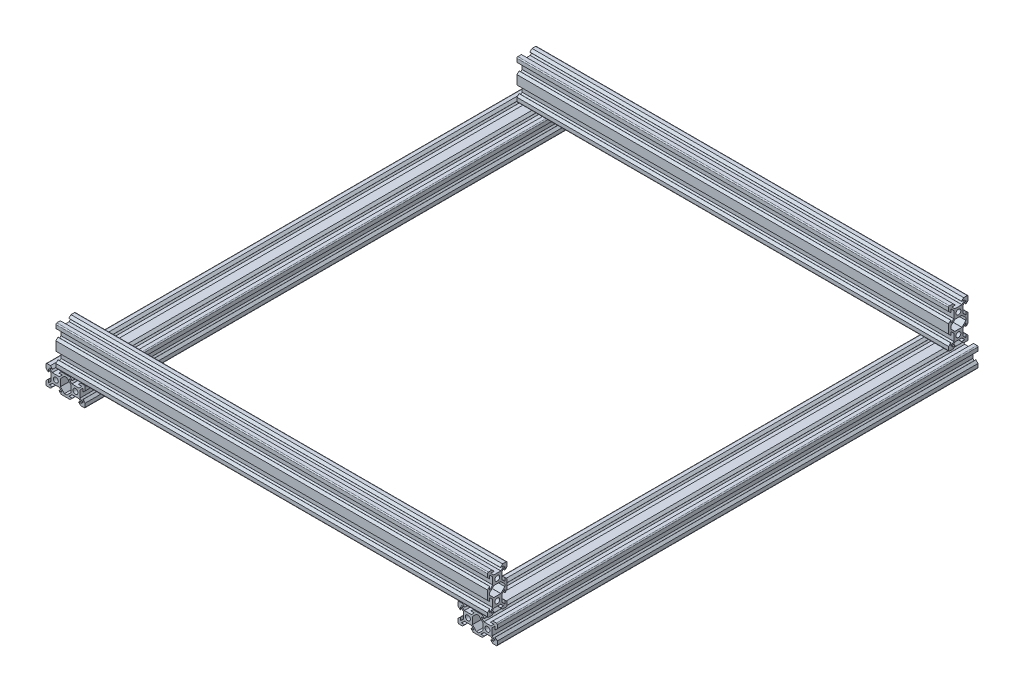
from build123d import *

# Parameters (mm, degrees)
CROQUIS4_R                   = 2.5
MIEMBRO_ESTRUCTURAL3_DEPTH   = 440
CROQUIS4_ON_SEGMENT_2_R      = 2.5
MIEMBRO_ESTRUCTURAL3_2_DEPTH = 440
CROQUIS41_R                  = 2.5
MIEMBRO_ESTRUCTURAL4_DEPTH   = 490
CROQUIS41_ON_SEGMENT_2_R     = 2.5
MIEMBRO_ESTRUCTURAL4_2_DEPTH = 490


with BuildPart() as part:
    # Croquis4 → Miembro estructural3 (new body)
    with BuildSketch(Plane(origin=(-220, 30, -235), x_dir=(0, 1, 0), z_dir=(1, 0, 0))):
        with BuildLine():
            Line((-19, -10), (-15.410285706, -10))
            Line((-15.410285706, -10), (-13.270710678, -7.860424973))
            ThreePointArc((-13.270710678, -7.860424973), (-13.249033403, -7.751445951), (-13.341421356, -7.689714294))
            Line((-13.341421356, -7.689714294), (-16.358578644, -7.689714294))
            ThreePointArc((-16.358578644, -7.689714294), (-16.450966597, -7.627982638), (-16.429289322, -7.519003616))
            Line((-16.429289322, -7.519003616), (-13.629289322, -4.719003616))
            ThreePointArc((-13.629289322, -4.719003616), (-13.596846987, -4.697326341), (-13.558578644, -4.689714294))
            Line((-13.558578644, -4.689714294), (-6.441421356, -4.689714294))
            ThreePointArc((-6.441421356, -4.689714294), (-6.403153013, -4.697326341), (-6.370710678, -4.719003616))
            Line((-6.370710678, -4.719003616), (-3.570710678, -7.519003616))
            ThreePointArc((-3.570710678, -7.519003616), (-3.549033403, -7.627982638), (-3.641421356, -7.689714294))
            Line((-3.641421356, -7.689714294), (-6.658578644, -7.689714294))
            ThreePointArc((-6.658578644, -7.689714294), (-6.750966597, -7.751445951), (-6.729289322, -7.860424973))
            Line((-6.729289322, -7.860424973), (-4.589714294, -10))
            Line((-4.589714294, -10), (4.589714294, -10))
            Line((4.589714294, -10), (6.729289322, -7.860424973))
            ThreePointArc((6.729289322, -7.860424973), (6.750966597, -7.751445951), (6.658578644, -7.689714294))
            Line((6.658578644, -7.689714294), (3.641421356, -7.689714294))
            ThreePointArc((3.641421356, -7.689714294), (3.549033403, -7.627982638), (3.570710678, -7.519003616))
            Line((3.570710678, -7.519003616), (6.370710678, -4.719003616))
            ThreePointArc((6.370710678, -4.719003616), (6.403153013, -4.697326341), (6.441421356, -4.689714294))
            Line((6.441421356, -4.689714294), (13.558578644, -4.689714294))
            ThreePointArc((13.558578644, -4.689714294), (13.596846987, -4.697326341), (13.629289322, -4.719003616))
            Line((13.629289322, -4.719003616), (16.429289322, -7.519003616))
            ThreePointArc((16.429289322, -7.519003616), (16.450966597, -7.627982638), (16.358578644, -7.689714294))
            Line((16.358578644, -7.689714294), (13.341421356, -7.689714294))
            ThreePointArc((13.341421356, -7.689714294), (13.249033403, -7.751445951), (13.270710678, -7.860424973))
            Line((13.270710678, -7.860424973), (15.410285706, -10))
            Line((15.410285706, -10), (19, -10))
            ThreePointArc((19, -10), (19.707106781, -9.707106781), (20, -9))
            Line((20, -9), (20, -5.410285706))
            Line((20, -5.410285706), (17.860424973, -3.270710678))
            ThreePointArc((17.860424973, -3.270710678), (17.751445951, -3.249033403), (17.689714294, -3.341421356))
            Line((17.689714294, -3.341421356), (17.689714294, -6.358578644))
            ThreePointArc((17.689714294, -6.358578644), (17.627982638, -6.450966597), (17.519003616, -6.429289322))
            Line((17.519003616, -6.429289322), (14.719003616, -3.629289322))
            ThreePointArc((14.719003616, -3.629289322), (14.697326341, -3.596846987), (14.689714294, -3.558578644))
            Line((14.689714294, -3.558578644), (14.689714294, 3.558578644))
            ThreePointArc((14.689714294, 3.558578644), (14.697326341, 3.596846987), (14.719003616, 3.629289322))
            Line((14.719003616, 3.629289322), (17.519003616, 6.429289322))
            ThreePointArc((17.519003616, 6.429289322), (17.627982638, 6.450966597), (17.689714294, 6.358578644))
            Line((17.689714294, 6.358578644), (17.689714294, 3.341421356))
            ThreePointArc((17.689714294, 3.341421356), (17.751445951, 3.249033403), (17.860424973, 3.270710678))
            Line((17.860424973, 3.270710678), (20, 5.410285706))
            Line((20, 5.410285706), (20, 9))
            ThreePointArc((20, 9), (19.707106781, 9.707106781), (19, 10))
            Line((19, 10), (15.410285706, 10))
            Line((15.410285706, 10), (13.270710678, 7.860424973))
            ThreePointArc((13.270710678, 7.860424973), (13.249033403, 7.751445951), (13.341421356, 7.689714294))
            Line((13.341421356, 7.689714294), (16.358578644, 7.689714294))
            ThreePointArc((16.358578644, 7.689714294), (16.450966597, 7.627982638), (16.429289322, 7.519003616))
            Line((16.429289322, 7.519003616), (13.629289322, 4.719003616))
            ThreePointArc((13.629289322, 4.719003616), (13.596846987, 4.697326341), (13.558578644, 4.689714294))
            Line((13.558578644, 4.689714294), (6.441421356, 4.689714294))
            ThreePointArc((6.441421356, 4.689714294), (6.403153013, 4.697326341), (6.370710678, 4.719003616))
            Line((6.370710678, 4.719003616), (3.570710678, 7.519003616))
            ThreePointArc((3.570710678, 7.519003616), (3.549033403, 7.627982638), (3.641421356, 7.689714294))
            Line((3.641421356, 7.689714294), (6.658578644, 7.689714294))
            ThreePointArc((6.658578644, 7.689714294), (6.750966597, 7.751445951), (6.729289322, 7.860424973))
            Line((6.729289322, 7.860424973), (4.589714294, 10))
            Line((4.589714294, 10), (-4.589714294, 10))
            Line((-4.589714294, 10), (-6.729289322, 7.860424973))
            ThreePointArc((-6.729289322, 7.860424973), (-6.750966597, 7.751445951), (-6.658578644, 7.689714294))
            Line((-6.658578644, 7.689714294), (-3.641421356, 7.689714294))
            ThreePointArc((-3.641421356, 7.689714294), (-3.549033403, 7.627982638), (-3.570710678, 7.519003616))
            Line((-3.570710678, 7.519003616), (-6.370710678, 4.719003616))
            ThreePointArc((-6.370710678, 4.719003616), (-6.403153013, 4.697326341), (-6.441421356, 4.689714294))
            Line((-6.441421356, 4.689714294), (-13.558578644, 4.689714294))
            ThreePointArc((-13.558578644, 4.689714294), (-13.596846987, 4.697326341), (-13.629289322, 4.719003616))
            Line((-13.629289322, 4.719003616), (-16.429289322, 7.519003616))
            ThreePointArc((-16.429289322, 7.519003616), (-16.450966597, 7.627982638), (-16.358578644, 7.689714294))
            Line((-16.358578644, 7.689714294), (-13.341421356, 7.689714294))
            ThreePointArc((-13.341421356, 7.689714294), (-13.249033403, 7.751445951), (-13.270710678, 7.860424973))
            Line((-13.270710678, 7.860424973), (-15.410285706, 10))
            Line((-15.410285706, 10), (-19, 10))
            ThreePointArc((-19, 10), (-19.707106781, 9.707106781), (-20, 9))
            Line((-20, 9), (-20, 5.410285706))
            Line((-20, 5.410285706), (-17.860424973, 3.270710678))
            ThreePointArc((-17.860424973, 3.270710678), (-17.751445951, 3.249033403), (-17.689714294, 3.341421356))
            Line((-17.689714294, 3.341421356), (-17.689714294, 6.358578644))
            ThreePointArc((-17.689714294, 6.358578644), (-17.627982638, 6.450966597), (-17.519003616, 6.429289322))
            Line((-17.519003616, 6.429289322), (-14.719003616, 3.629289322))
            ThreePointArc((-14.719003616, 3.629289322), (-14.697326341, 3.596846987), (-14.689714294, 3.558578644))
            Line((-14.689714294, 3.558578644), (-14.689714294, -3.558578644))
            ThreePointArc((-14.689714294, -3.558578644), (-14.697326341, -3.596846987), (-14.719003616, -3.629289322))
            Line((-14.719003616, -3.629289322), (-17.519003616, -6.429289322))
            ThreePointArc((-17.519003616, -6.429289322), (-17.627982638, -6.450966597), (-17.689714294, -6.358578644))
            Line((-17.689714294, -6.358578644), (-17.689714294, -3.341421356))
            ThreePointArc((-17.689714294, -3.341421356), (-17.751445951, -3.249033403), (-17.860424973, -3.270710678))
            Line((-17.860424973, -3.270710678), (-20, -5.410285706))
            Line((-20, -5.410285706), (-20, -9))
            ThreePointArc((-20, -9), (-19.707106781, -9.707106781), (-19, -10))
        make_face()
        with Locations((-10, 0)):
            Circle(CROQUIS4_R, mode=Mode.SUBTRACT)
        with Locations((10, 0)):
            Circle(CROQUIS4_R, mode=Mode.SUBTRACT)
        with BuildLine():
            Line((-2.480996384, 6.429289322), (-5.280996384, 3.629289322))
            ThreePointArc((-5.280996384, 3.629289322), (-5.302673659, 3.596846987), (-5.310285706, 3.558578644))
            Line((-5.310285706, 3.558578644), (-5.310285706, -3.558578644))
            ThreePointArc((-5.310285706, -3.558578644), (-5.302673659, -3.596846987), (-5.280996384, -3.629289322))
            Line((-5.280996384, -3.629289322), (-2.480996384, -6.429289322))
            Line((-2.480996384, -6.429289322), (-1.220571411, -7.689714294))
            Line((-1.220571411, -7.689714294), (1.220571411, -7.689714294))
            Line((1.220571411, -7.689714294), (2.480996384, -6.429289322))
            Line((2.480996384, -6.429289322), (5.280996384, -3.629289322))
            ThreePointArc((5.280996384, -3.629289322), (5.302673659, -3.596846987), (5.310285706, -3.558578644))
            Line((5.310285706, -3.558578644), (5.310285706, 3.558578644))
            ThreePointArc((5.310285706, 3.558578644), (5.302673659, 3.596846987), (5.280996384, 3.629289322))
            Line((5.280996384, 3.629289322), (2.480996384, 6.429289322))
            Line((2.480996384, 6.429289322), (1.220571411, 7.689714294))
            Line((1.220571411, 7.689714294), (-1.220571411, 7.689714294))
            Line((-1.220571411, 7.689714294), (-2.480996384, 6.429289322))
        make_face(mode=Mode.SUBTRACT)
    extrude(amount=MIEMBRO_ESTRUCTURAL3_DEPTH)


with BuildPart() as body_2:
    # Croquis4 on segment 2 (carried to segment 2) → Miembro estructural3 2 (new body)
    with BuildSketch(Plane(origin=(-220, 30, 235), x_dir=(0, 1, 0), z_dir=(1, 0, 0))):
        with BuildLine():
            Line((-19, -10), (-15.410285706, -10))
            Line((-15.410285706, -10), (-13.270710678, -7.860424973))
            ThreePointArc((-13.270710678, -7.860424973), (-13.249033403, -7.751445951), (-13.341421356, -7.689714294))
            Line((-13.341421356, -7.689714294), (-16.358578644, -7.689714294))
            ThreePointArc((-16.358578644, -7.689714294), (-16.450966597, -7.627982638), (-16.429289322, -7.519003616))
            Line((-16.429289322, -7.519003616), (-13.629289322, -4.719003616))
            ThreePointArc((-13.629289322, -4.719003616), (-13.596846987, -4.697326341), (-13.558578644, -4.689714294))
            Line((-13.558578644, -4.689714294), (-6.441421356, -4.689714294))
            ThreePointArc((-6.441421356, -4.689714294), (-6.403153013, -4.697326341), (-6.370710678, -4.719003616))
            Line((-6.370710678, -4.719003616), (-3.570710678, -7.519003616))
            ThreePointArc((-3.570710678, -7.519003616), (-3.549033403, -7.627982638), (-3.641421356, -7.689714294))
            Line((-3.641421356, -7.689714294), (-6.658578644, -7.689714294))
            ThreePointArc((-6.658578644, -7.689714294), (-6.750966597, -7.751445951), (-6.729289322, -7.860424973))
            Line((-6.729289322, -7.860424973), (-4.589714294, -10))
            Line((-4.589714294, -10), (4.589714294, -10))
            Line((4.589714294, -10), (6.729289322, -7.860424973))
            ThreePointArc((6.729289322, -7.860424973), (6.750966597, -7.751445951), (6.658578644, -7.689714294))
            Line((6.658578644, -7.689714294), (3.641421356, -7.689714294))
            ThreePointArc((3.641421356, -7.689714294), (3.549033403, -7.627982638), (3.570710678, -7.519003616))
            Line((3.570710678, -7.519003616), (6.370710678, -4.719003616))
            ThreePointArc((6.370710678, -4.719003616), (6.403153013, -4.697326341), (6.441421356, -4.689714294))
            Line((6.441421356, -4.689714294), (13.558578644, -4.689714294))
            ThreePointArc((13.558578644, -4.689714294), (13.596846987, -4.697326341), (13.629289322, -4.719003616))
            Line((13.629289322, -4.719003616), (16.429289322, -7.519003616))
            ThreePointArc((16.429289322, -7.519003616), (16.450966597, -7.627982638), (16.358578644, -7.689714294))
            Line((16.358578644, -7.689714294), (13.341421356, -7.689714294))
            ThreePointArc((13.341421356, -7.689714294), (13.249033403, -7.751445951), (13.270710678, -7.860424973))
            Line((13.270710678, -7.860424973), (15.410285706, -10))
            Line((15.410285706, -10), (19, -10))
            ThreePointArc((19, -10), (19.707106781, -9.707106781), (20, -9))
            Line((20, -9), (20, -5.410285706))
            Line((20, -5.410285706), (17.860424973, -3.270710678))
            ThreePointArc((17.860424973, -3.270710678), (17.751445951, -3.249033403), (17.689714294, -3.341421356))
            Line((17.689714294, -3.341421356), (17.689714294, -6.358578644))
            ThreePointArc((17.689714294, -6.358578644), (17.627982638, -6.450966597), (17.519003616, -6.429289322))
            Line((17.519003616, -6.429289322), (14.719003616, -3.629289322))
            ThreePointArc((14.719003616, -3.629289322), (14.697326341, -3.596846987), (14.689714294, -3.558578644))
            Line((14.689714294, -3.558578644), (14.689714294, 3.558578644))
            ThreePointArc((14.689714294, 3.558578644), (14.697326341, 3.596846987), (14.719003616, 3.629289322))
            Line((14.719003616, 3.629289322), (17.519003616, 6.429289322))
            ThreePointArc((17.519003616, 6.429289322), (17.627982638, 6.450966597), (17.689714294, 6.358578644))
            Line((17.689714294, 6.358578644), (17.689714294, 3.341421356))
            ThreePointArc((17.689714294, 3.341421356), (17.751445951, 3.249033403), (17.860424973, 3.270710678))
            Line((17.860424973, 3.270710678), (20, 5.410285706))
            Line((20, 5.410285706), (20, 9))
            ThreePointArc((20, 9), (19.707106781, 9.707106781), (19, 10))
            Line((19, 10), (15.410285706, 10))
            Line((15.410285706, 10), (13.270710678, 7.860424973))
            ThreePointArc((13.270710678, 7.860424973), (13.249033403, 7.751445951), (13.341421356, 7.689714294))
            Line((13.341421356, 7.689714294), (16.358578644, 7.689714294))
            ThreePointArc((16.358578644, 7.689714294), (16.450966597, 7.627982638), (16.429289322, 7.519003616))
            Line((16.429289322, 7.519003616), (13.629289322, 4.719003616))
            ThreePointArc((13.629289322, 4.719003616), (13.596846987, 4.697326341), (13.558578644, 4.689714294))
            Line((13.558578644, 4.689714294), (6.441421356, 4.689714294))
            ThreePointArc((6.441421356, 4.689714294), (6.403153013, 4.697326341), (6.370710678, 4.719003616))
            Line((6.370710678, 4.719003616), (3.570710678, 7.519003616))
            ThreePointArc((3.570710678, 7.519003616), (3.549033403, 7.627982638), (3.641421356, 7.689714294))
            Line((3.641421356, 7.689714294), (6.658578644, 7.689714294))
            ThreePointArc((6.658578644, 7.689714294), (6.750966597, 7.751445951), (6.729289322, 7.860424973))
            Line((6.729289322, 7.860424973), (4.589714294, 10))
            Line((4.589714294, 10), (-4.589714294, 10))
            Line((-4.589714294, 10), (-6.729289322, 7.860424973))
            ThreePointArc((-6.729289322, 7.860424973), (-6.750966597, 7.751445951), (-6.658578644, 7.689714294))
            Line((-6.658578644, 7.689714294), (-3.641421356, 7.689714294))
            ThreePointArc((-3.641421356, 7.689714294), (-3.549033403, 7.627982638), (-3.570710678, 7.519003616))
            Line((-3.570710678, 7.519003616), (-6.370710678, 4.719003616))
            ThreePointArc((-6.370710678, 4.719003616), (-6.403153013, 4.697326341), (-6.441421356, 4.689714294))
            Line((-6.441421356, 4.689714294), (-13.558578644, 4.689714294))
            ThreePointArc((-13.558578644, 4.689714294), (-13.596846987, 4.697326341), (-13.629289322, 4.719003616))
            Line((-13.629289322, 4.719003616), (-16.429289322, 7.519003616))
            ThreePointArc((-16.429289322, 7.519003616), (-16.450966597, 7.627982638), (-16.358578644, 7.689714294))
            Line((-16.358578644, 7.689714294), (-13.341421356, 7.689714294))
            ThreePointArc((-13.341421356, 7.689714294), (-13.249033403, 7.751445951), (-13.270710678, 7.860424973))
            Line((-13.270710678, 7.860424973), (-15.410285706, 10))
            Line((-15.410285706, 10), (-19, 10))
            ThreePointArc((-19, 10), (-19.707106781, 9.707106781), (-20, 9))
            Line((-20, 9), (-20, 5.410285706))
            Line((-20, 5.410285706), (-17.860424973, 3.270710678))
            ThreePointArc((-17.860424973, 3.270710678), (-17.751445951, 3.249033403), (-17.689714294, 3.341421356))
            Line((-17.689714294, 3.341421356), (-17.689714294, 6.358578644))
            ThreePointArc((-17.689714294, 6.358578644), (-17.627982638, 6.450966597), (-17.519003616, 6.429289322))
            Line((-17.519003616, 6.429289322), (-14.719003616, 3.629289322))
            ThreePointArc((-14.719003616, 3.629289322), (-14.697326341, 3.596846987), (-14.689714294, 3.558578644))
            Line((-14.689714294, 3.558578644), (-14.689714294, -3.558578644))
            ThreePointArc((-14.689714294, -3.558578644), (-14.697326341, -3.596846987), (-14.719003616, -3.629289322))
            Line((-14.719003616, -3.629289322), (-17.519003616, -6.429289322))
            ThreePointArc((-17.519003616, -6.429289322), (-17.627982638, -6.450966597), (-17.689714294, -6.358578644))
            Line((-17.689714294, -6.358578644), (-17.689714294, -3.341421356))
            ThreePointArc((-17.689714294, -3.341421356), (-17.751445951, -3.249033403), (-17.860424973, -3.270710678))
            Line((-17.860424973, -3.270710678), (-20, -5.410285706))
            Line((-20, -5.410285706), (-20, -9))
            ThreePointArc((-20, -9), (-19.707106781, -9.707106781), (-19, -10))
        make_face()
        with Locations((-10, 0)):
            Circle(CROQUIS4_ON_SEGMENT_2_R, mode=Mode.SUBTRACT)
        with Locations((10, 0)):
            Circle(CROQUIS4_ON_SEGMENT_2_R, mode=Mode.SUBTRACT)
        with BuildLine():
            Line((-2.480996384, 6.429289322), (-5.280996384, 3.629289322))
            ThreePointArc((-5.280996384, 3.629289322), (-5.302673659, 3.596846987), (-5.310285706, 3.558578644))
            Line((-5.310285706, 3.558578644), (-5.310285706, -3.558578644))
            ThreePointArc((-5.310285706, -3.558578644), (-5.302673659, -3.596846987), (-5.280996384, -3.629289322))
            Line((-5.280996384, -3.629289322), (-2.480996384, -6.429289322))
            Line((-2.480996384, -6.429289322), (-1.220571411, -7.689714294))
            Line((-1.220571411, -7.689714294), (1.220571411, -7.689714294))
            Line((1.220571411, -7.689714294), (2.480996384, -6.429289322))
            Line((2.480996384, -6.429289322), (5.280996384, -3.629289322))
            ThreePointArc((5.280996384, -3.629289322), (5.302673659, -3.596846987), (5.310285706, -3.558578644))
            Line((5.310285706, -3.558578644), (5.310285706, 3.558578644))
            ThreePointArc((5.310285706, 3.558578644), (5.302673659, 3.596846987), (5.280996384, 3.629289322))
            Line((5.280996384, 3.629289322), (2.480996384, 6.429289322))
            Line((2.480996384, 6.429289322), (1.220571411, 7.689714294))
            Line((1.220571411, 7.689714294), (-1.220571411, 7.689714294))
            Line((-1.220571411, 7.689714294), (-2.480996384, 6.429289322))
        make_face(mode=Mode.SUBTRACT)
    extrude(amount=MIEMBRO_ESTRUCTURAL3_2_DEPTH)


with BuildPart() as body_3:
    # Croquis41 → Miembro estructural4 (new body)
    with BuildSketch(Plane(origin=(-210, 0, -245), x_dir=(1, 0, 0), z_dir=(0, 0, 1))):
        with BuildLine():
            Line((-19, -10), (-15.410285706, -10))
            Line((-15.410285706, -10), (-13.270710678, -7.860424973))
            ThreePointArc((-13.270710678, -7.860424973), (-13.249033403, -7.751445951), (-13.341421356, -7.689714294))
            Line((-13.341421356, -7.689714294), (-16.358578644, -7.689714294))
            ThreePointArc((-16.358578644, -7.689714294), (-16.450966597, -7.627982638), (-16.429289322, -7.519003616))
            Line((-16.429289322, -7.519003616), (-13.629289322, -4.719003616))
            ThreePointArc((-13.629289322, -4.719003616), (-13.596846987, -4.697326341), (-13.558578644, -4.689714294))
            Line((-13.558578644, -4.689714294), (-6.441421356, -4.689714294))
            ThreePointArc((-6.441421356, -4.689714294), (-6.403153013, -4.697326341), (-6.370710678, -4.719003616))
            Line((-6.370710678, -4.719003616), (-3.570710678, -7.519003616))
            ThreePointArc((-3.570710678, -7.519003616), (-3.549033403, -7.627982638), (-3.641421356, -7.689714294))
            Line((-3.641421356, -7.689714294), (-6.658578644, -7.689714294))
            ThreePointArc((-6.658578644, -7.689714294), (-6.750966597, -7.751445951), (-6.729289322, -7.860424973))
            Line((-6.729289322, -7.860424973), (-4.589714294, -10))
            Line((-4.589714294, -10), (4.589714294, -10))
            Line((4.589714294, -10), (6.729289322, -7.860424973))
            ThreePointArc((6.729289322, -7.860424973), (6.750966597, -7.751445951), (6.658578644, -7.689714294))
            Line((6.658578644, -7.689714294), (3.641421356, -7.689714294))
            ThreePointArc((3.641421356, -7.689714294), (3.549033403, -7.627982638), (3.570710678, -7.519003616))
            Line((3.570710678, -7.519003616), (6.370710678, -4.719003616))
            ThreePointArc((6.370710678, -4.719003616), (6.403153013, -4.697326341), (6.441421356, -4.689714294))
            Line((6.441421356, -4.689714294), (13.558578644, -4.689714294))
            ThreePointArc((13.558578644, -4.689714294), (13.596846987, -4.697326341), (13.629289322, -4.719003616))
            Line((13.629289322, -4.719003616), (16.429289322, -7.519003616))
            ThreePointArc((16.429289322, -7.519003616), (16.450966597, -7.627982638), (16.358578644, -7.689714294))
            Line((16.358578644, -7.689714294), (13.341421356, -7.689714294))
            ThreePointArc((13.341421356, -7.689714294), (13.249033403, -7.751445951), (13.270710678, -7.860424973))
            Line((13.270710678, -7.860424973), (15.410285706, -10))
            Line((15.410285706, -10), (19, -10))
            ThreePointArc((19, -10), (19.707106781, -9.707106781), (20, -9))
            Line((20, -9), (20, -5.410285706))
            Line((20, -5.410285706), (17.860424973, -3.270710678))
            ThreePointArc((17.860424973, -3.270710678), (17.751445951, -3.249033403), (17.689714294, -3.341421356))
            Line((17.689714294, -3.341421356), (17.689714294, -6.358578644))
            ThreePointArc((17.689714294, -6.358578644), (17.627982638, -6.450966597), (17.519003616, -6.429289322))
            Line((17.519003616, -6.429289322), (14.719003616, -3.629289322))
            ThreePointArc((14.719003616, -3.629289322), (14.697326341, -3.596846987), (14.689714294, -3.558578644))
            Line((14.689714294, -3.558578644), (14.689714294, 3.558578644))
            ThreePointArc((14.689714294, 3.558578644), (14.697326341, 3.596846987), (14.719003616, 3.629289322))
            Line((14.719003616, 3.629289322), (17.519003616, 6.429289322))
            ThreePointArc((17.519003616, 6.429289322), (17.627982638, 6.450966597), (17.689714294, 6.358578644))
            Line((17.689714294, 6.358578644), (17.689714294, 3.341421356))
            ThreePointArc((17.689714294, 3.341421356), (17.751445951, 3.249033403), (17.860424973, 3.270710678))
            Line((17.860424973, 3.270710678), (20, 5.410285706))
            Line((20, 5.410285706), (20, 9))
            ThreePointArc((20, 9), (19.707106781, 9.707106781), (19, 10))
            Line((19, 10), (15.410285706, 10))
            Line((15.410285706, 10), (13.270710678, 7.860424973))
            ThreePointArc((13.270710678, 7.860424973), (13.249033403, 7.751445951), (13.341421356, 7.689714294))
            Line((13.341421356, 7.689714294), (16.358578644, 7.689714294))
            ThreePointArc((16.358578644, 7.689714294), (16.450966597, 7.627982638), (16.429289322, 7.519003616))
            Line((16.429289322, 7.519003616), (13.629289322, 4.719003616))
            ThreePointArc((13.629289322, 4.719003616), (13.596846987, 4.697326341), (13.558578644, 4.689714294))
            Line((13.558578644, 4.689714294), (6.441421356, 4.689714294))
            ThreePointArc((6.441421356, 4.689714294), (6.403153013, 4.697326341), (6.370710678, 4.719003616))
            Line((6.370710678, 4.719003616), (3.570710678, 7.519003616))
            ThreePointArc((3.570710678, 7.519003616), (3.549033403, 7.627982638), (3.641421356, 7.689714294))
            Line((3.641421356, 7.689714294), (6.658578644, 7.689714294))
            ThreePointArc((6.658578644, 7.689714294), (6.750966597, 7.751445951), (6.729289322, 7.860424973))
            Line((6.729289322, 7.860424973), (4.589714294, 10))
            Line((4.589714294, 10), (-4.589714294, 10))
            Line((-4.589714294, 10), (-6.729289322, 7.860424973))
            ThreePointArc((-6.729289322, 7.860424973), (-6.750966597, 7.751445951), (-6.658578644, 7.689714294))
            Line((-6.658578644, 7.689714294), (-3.641421356, 7.689714294))
            ThreePointArc((-3.641421356, 7.689714294), (-3.549033403, 7.627982638), (-3.570710678, 7.519003616))
            Line((-3.570710678, 7.519003616), (-6.370710678, 4.719003616))
            ThreePointArc((-6.370710678, 4.719003616), (-6.403153013, 4.697326341), (-6.441421356, 4.689714294))
            Line((-6.441421356, 4.689714294), (-13.558578644, 4.689714294))
            ThreePointArc((-13.558578644, 4.689714294), (-13.596846987, 4.697326341), (-13.629289322, 4.719003616))
            Line((-13.629289322, 4.719003616), (-16.429289322, 7.519003616))
            ThreePointArc((-16.429289322, 7.519003616), (-16.450966597, 7.627982638), (-16.358578644, 7.689714294))
            Line((-16.358578644, 7.689714294), (-13.341421356, 7.689714294))
            ThreePointArc((-13.341421356, 7.689714294), (-13.249033403, 7.751445951), (-13.270710678, 7.860424973))
            Line((-13.270710678, 7.860424973), (-15.410285706, 10))
            Line((-15.410285706, 10), (-19, 10))
            ThreePointArc((-19, 10), (-19.707106781, 9.707106781), (-20, 9))
            Line((-20, 9), (-20, 5.410285706))
            Line((-20, 5.410285706), (-17.860424973, 3.270710678))
            ThreePointArc((-17.860424973, 3.270710678), (-17.751445951, 3.249033403), (-17.689714294, 3.341421356))
            Line((-17.689714294, 3.341421356), (-17.689714294, 6.358578644))
            ThreePointArc((-17.689714294, 6.358578644), (-17.627982638, 6.450966597), (-17.519003616, 6.429289322))
            Line((-17.519003616, 6.429289322), (-14.719003616, 3.629289322))
            ThreePointArc((-14.719003616, 3.629289322), (-14.697326341, 3.596846987), (-14.689714294, 3.558578644))
            Line((-14.689714294, 3.558578644), (-14.689714294, -3.558578644))
            ThreePointArc((-14.689714294, -3.558578644), (-14.697326341, -3.596846987), (-14.719003616, -3.629289322))
            Line((-14.719003616, -3.629289322), (-17.519003616, -6.429289322))
            ThreePointArc((-17.519003616, -6.429289322), (-17.627982638, -6.450966597), (-17.689714294, -6.358578644))
            Line((-17.689714294, -6.358578644), (-17.689714294, -3.341421356))
            ThreePointArc((-17.689714294, -3.341421356), (-17.751445951, -3.249033403), (-17.860424973, -3.270710678))
            Line((-17.860424973, -3.270710678), (-20, -5.410285706))
            Line((-20, -5.410285706), (-20, -9))
            ThreePointArc((-20, -9), (-19.707106781, -9.707106781), (-19, -10))
        make_face()
        with Locations((-10, 0)):
            Circle(CROQUIS41_R, mode=Mode.SUBTRACT)
        with Locations((10, 0)):
            Circle(CROQUIS41_R, mode=Mode.SUBTRACT)
        with BuildLine():
            Line((-2.480996384, 6.429289322), (-5.280996384, 3.629289322))
            ThreePointArc((-5.280996384, 3.629289322), (-5.302673659, 3.596846987), (-5.310285706, 3.558578644))
            Line((-5.310285706, 3.558578644), (-5.310285706, -3.558578644))
            ThreePointArc((-5.310285706, -3.558578644), (-5.302673659, -3.596846987), (-5.280996384, -3.629289322))
            Line((-5.280996384, -3.629289322), (-2.480996384, -6.429289322))
            Line((-2.480996384, -6.429289322), (-1.220571411, -7.689714294))
            Line((-1.220571411, -7.689714294), (1.220571411, -7.689714294))
            Line((1.220571411, -7.689714294), (2.480996384, -6.429289322))
            Line((2.480996384, -6.429289322), (5.280996384, -3.629289322))
            ThreePointArc((5.280996384, -3.629289322), (5.302673659, -3.596846987), (5.310285706, -3.558578644))
            Line((5.310285706, -3.558578644), (5.310285706, 3.558578644))
            ThreePointArc((5.310285706, 3.558578644), (5.302673659, 3.596846987), (5.280996384, 3.629289322))
            Line((5.280996384, 3.629289322), (2.480996384, 6.429289322))
            Line((2.480996384, 6.429289322), (1.220571411, 7.689714294))
            Line((1.220571411, 7.689714294), (-1.220571411, 7.689714294))
            Line((-1.220571411, 7.689714294), (-2.480996384, 6.429289322))
        make_face(mode=Mode.SUBTRACT)
    extrude(amount=MIEMBRO_ESTRUCTURAL4_DEPTH)


with BuildPart() as body_4:
    # Croquis41 on segment 2 (carried to segment 2) → Miembro estructural4 2 (new body)
    with BuildSketch(Plane(origin=(210, 0, -245), x_dir=(1, 0, 0), z_dir=(0, 0, 1))):
        with BuildLine():
            Line((-19, -10), (-15.410285706, -10))
            Line((-15.410285706, -10), (-13.270710678, -7.860424973))
            ThreePointArc((-13.270710678, -7.860424973), (-13.249033403, -7.751445951), (-13.341421356, -7.689714294))
            Line((-13.341421356, -7.689714294), (-16.358578644, -7.689714294))
            ThreePointArc((-16.358578644, -7.689714294), (-16.450966597, -7.627982638), (-16.429289322, -7.519003616))
            Line((-16.429289322, -7.519003616), (-13.629289322, -4.719003616))
            ThreePointArc((-13.629289322, -4.719003616), (-13.596846987, -4.697326341), (-13.558578644, -4.689714294))
            Line((-13.558578644, -4.689714294), (-6.441421356, -4.689714294))
            ThreePointArc((-6.441421356, -4.689714294), (-6.403153013, -4.697326341), (-6.370710678, -4.719003616))
            Line((-6.370710678, -4.719003616), (-3.570710678, -7.519003616))
            ThreePointArc((-3.570710678, -7.519003616), (-3.549033403, -7.627982638), (-3.641421356, -7.689714294))
            Line((-3.641421356, -7.689714294), (-6.658578644, -7.689714294))
            ThreePointArc((-6.658578644, -7.689714294), (-6.750966597, -7.751445951), (-6.729289322, -7.860424973))
            Line((-6.729289322, -7.860424973), (-4.589714294, -10))
            Line((-4.589714294, -10), (4.589714294, -10))
            Line((4.589714294, -10), (6.729289322, -7.860424973))
            ThreePointArc((6.729289322, -7.860424973), (6.750966597, -7.751445951), (6.658578644, -7.689714294))
            Line((6.658578644, -7.689714294), (3.641421356, -7.689714294))
            ThreePointArc((3.641421356, -7.689714294), (3.549033403, -7.627982638), (3.570710678, -7.519003616))
            Line((3.570710678, -7.519003616), (6.370710678, -4.719003616))
            ThreePointArc((6.370710678, -4.719003616), (6.403153013, -4.697326341), (6.441421356, -4.689714294))
            Line((6.441421356, -4.689714294), (13.558578644, -4.689714294))
            ThreePointArc((13.558578644, -4.689714294), (13.596846987, -4.697326341), (13.629289322, -4.719003616))
            Line((13.629289322, -4.719003616), (16.429289322, -7.519003616))
            ThreePointArc((16.429289322, -7.519003616), (16.450966597, -7.627982638), (16.358578644, -7.689714294))
            Line((16.358578644, -7.689714294), (13.341421356, -7.689714294))
            ThreePointArc((13.341421356, -7.689714294), (13.249033403, -7.751445951), (13.270710678, -7.860424973))
            Line((13.270710678, -7.860424973), (15.410285706, -10))
            Line((15.410285706, -10), (19, -10))
            ThreePointArc((19, -10), (19.707106781, -9.707106781), (20, -9))
            Line((20, -9), (20, -5.410285706))
            Line((20, -5.410285706), (17.860424973, -3.270710678))
            ThreePointArc((17.860424973, -3.270710678), (17.751445951, -3.249033403), (17.689714294, -3.341421356))
            Line((17.689714294, -3.341421356), (17.689714294, -6.358578644))
            ThreePointArc((17.689714294, -6.358578644), (17.627982638, -6.450966597), (17.519003616, -6.429289322))
            Line((17.519003616, -6.429289322), (14.719003616, -3.629289322))
            ThreePointArc((14.719003616, -3.629289322), (14.697326341, -3.596846987), (14.689714294, -3.558578644))
            Line((14.689714294, -3.558578644), (14.689714294, 3.558578644))
            ThreePointArc((14.689714294, 3.558578644), (14.697326341, 3.596846987), (14.719003616, 3.629289322))
            Line((14.719003616, 3.629289322), (17.519003616, 6.429289322))
            ThreePointArc((17.519003616, 6.429289322), (17.627982638, 6.450966597), (17.689714294, 6.358578644))
            Line((17.689714294, 6.358578644), (17.689714294, 3.341421356))
            ThreePointArc((17.689714294, 3.341421356), (17.751445951, 3.249033403), (17.860424973, 3.270710678))
            Line((17.860424973, 3.270710678), (20, 5.410285706))
            Line((20, 5.410285706), (20, 9))
            ThreePointArc((20, 9), (19.707106781, 9.707106781), (19, 10))
            Line((19, 10), (15.410285706, 10))
            Line((15.410285706, 10), (13.270710678, 7.860424973))
            ThreePointArc((13.270710678, 7.860424973), (13.249033403, 7.751445951), (13.341421356, 7.689714294))
            Line((13.341421356, 7.689714294), (16.358578644, 7.689714294))
            ThreePointArc((16.358578644, 7.689714294), (16.450966597, 7.627982638), (16.429289322, 7.519003616))
            Line((16.429289322, 7.519003616), (13.629289322, 4.719003616))
            ThreePointArc((13.629289322, 4.719003616), (13.596846987, 4.697326341), (13.558578644, 4.689714294))
            Line((13.558578644, 4.689714294), (6.441421356, 4.689714294))
            ThreePointArc((6.441421356, 4.689714294), (6.403153013, 4.697326341), (6.370710678, 4.719003616))
            Line((6.370710678, 4.719003616), (3.570710678, 7.519003616))
            ThreePointArc((3.570710678, 7.519003616), (3.549033403, 7.627982638), (3.641421356, 7.689714294))
            Line((3.641421356, 7.689714294), (6.658578644, 7.689714294))
            ThreePointArc((6.658578644, 7.689714294), (6.750966597, 7.751445951), (6.729289322, 7.860424973))
            Line((6.729289322, 7.860424973), (4.589714294, 10))
            Line((4.589714294, 10), (-4.589714294, 10))
            Line((-4.589714294, 10), (-6.729289322, 7.860424973))
            ThreePointArc((-6.729289322, 7.860424973), (-6.750966597, 7.751445951), (-6.658578644, 7.689714294))
            Line((-6.658578644, 7.689714294), (-3.641421356, 7.689714294))
            ThreePointArc((-3.641421356, 7.689714294), (-3.549033403, 7.627982638), (-3.570710678, 7.519003616))
            Line((-3.570710678, 7.519003616), (-6.370710678, 4.719003616))
            ThreePointArc((-6.370710678, 4.719003616), (-6.403153013, 4.697326341), (-6.441421356, 4.689714294))
            Line((-6.441421356, 4.689714294), (-13.558578644, 4.689714294))
            ThreePointArc((-13.558578644, 4.689714294), (-13.596846987, 4.697326341), (-13.629289322, 4.719003616))
            Line((-13.629289322, 4.719003616), (-16.429289322, 7.519003616))
            ThreePointArc((-16.429289322, 7.519003616), (-16.450966597, 7.627982638), (-16.358578644, 7.689714294))
            Line((-16.358578644, 7.689714294), (-13.341421356, 7.689714294))
            ThreePointArc((-13.341421356, 7.689714294), (-13.249033403, 7.751445951), (-13.270710678, 7.860424973))
            Line((-13.270710678, 7.860424973), (-15.410285706, 10))
            Line((-15.410285706, 10), (-19, 10))
            ThreePointArc((-19, 10), (-19.707106781, 9.707106781), (-20, 9))
            Line((-20, 9), (-20, 5.410285706))
            Line((-20, 5.410285706), (-17.860424973, 3.270710678))
            ThreePointArc((-17.860424973, 3.270710678), (-17.751445951, 3.249033403), (-17.689714294, 3.341421356))
            Line((-17.689714294, 3.341421356), (-17.689714294, 6.358578644))
            ThreePointArc((-17.689714294, 6.358578644), (-17.627982638, 6.450966597), (-17.519003616, 6.429289322))
            Line((-17.519003616, 6.429289322), (-14.719003616, 3.629289322))
            ThreePointArc((-14.719003616, 3.629289322), (-14.697326341, 3.596846987), (-14.689714294, 3.558578644))
            Line((-14.689714294, 3.558578644), (-14.689714294, -3.558578644))
            ThreePointArc((-14.689714294, -3.558578644), (-14.697326341, -3.596846987), (-14.719003616, -3.629289322))
            Line((-14.719003616, -3.629289322), (-17.519003616, -6.429289322))
            ThreePointArc((-17.519003616, -6.429289322), (-17.627982638, -6.450966597), (-17.689714294, -6.358578644))
            Line((-17.689714294, -6.358578644), (-17.689714294, -3.341421356))
            ThreePointArc((-17.689714294, -3.341421356), (-17.751445951, -3.249033403), (-17.860424973, -3.270710678))
            Line((-17.860424973, -3.270710678), (-20, -5.410285706))
            Line((-20, -5.410285706), (-20, -9))
            ThreePointArc((-20, -9), (-19.707106781, -9.707106781), (-19, -10))
        make_face()
        with Locations((-10, 0)):
            Circle(CROQUIS41_ON_SEGMENT_2_R, mode=Mode.SUBTRACT)
        with Locations((10, 0)):
            Circle(CROQUIS41_ON_SEGMENT_2_R, mode=Mode.SUBTRACT)
        with BuildLine():
            Line((-2.480996384, 6.429289322), (-5.280996384, 3.629289322))
            ThreePointArc((-5.280996384, 3.629289322), (-5.302673659, 3.596846987), (-5.310285706, 3.558578644))
            Line((-5.310285706, 3.558578644), (-5.310285706, -3.558578644))
            ThreePointArc((-5.310285706, -3.558578644), (-5.302673659, -3.596846987), (-5.280996384, -3.629289322))
            Line((-5.280996384, -3.629289322), (-2.480996384, -6.429289322))
            Line((-2.480996384, -6.429289322), (-1.220571411, -7.689714294))
            Line((-1.220571411, -7.689714294), (1.220571411, -7.689714294))
            Line((1.220571411, -7.689714294), (2.480996384, -6.429289322))
            Line((2.480996384, -6.429289322), (5.280996384, -3.629289322))
            ThreePointArc((5.280996384, -3.629289322), (5.302673659, -3.596846987), (5.310285706, -3.558578644))
            Line((5.310285706, -3.558578644), (5.310285706, 3.558578644))
            ThreePointArc((5.310285706, 3.558578644), (5.302673659, 3.596846987), (5.280996384, 3.629289322))
            Line((5.280996384, 3.629289322), (2.480996384, 6.429289322))
            Line((2.480996384, 6.429289322), (1.220571411, 7.689714294))
            Line((1.220571411, 7.689714294), (-1.220571411, 7.689714294))
            Line((-1.220571411, 7.689714294), (-2.480996384, 6.429289322))
        make_face(mode=Mode.SUBTRACT)
    extrude(amount=MIEMBRO_ESTRUCTURAL4_2_DEPTH)


solid = Compound([part.part, body_2.part, body_3.part, body_4.part])
